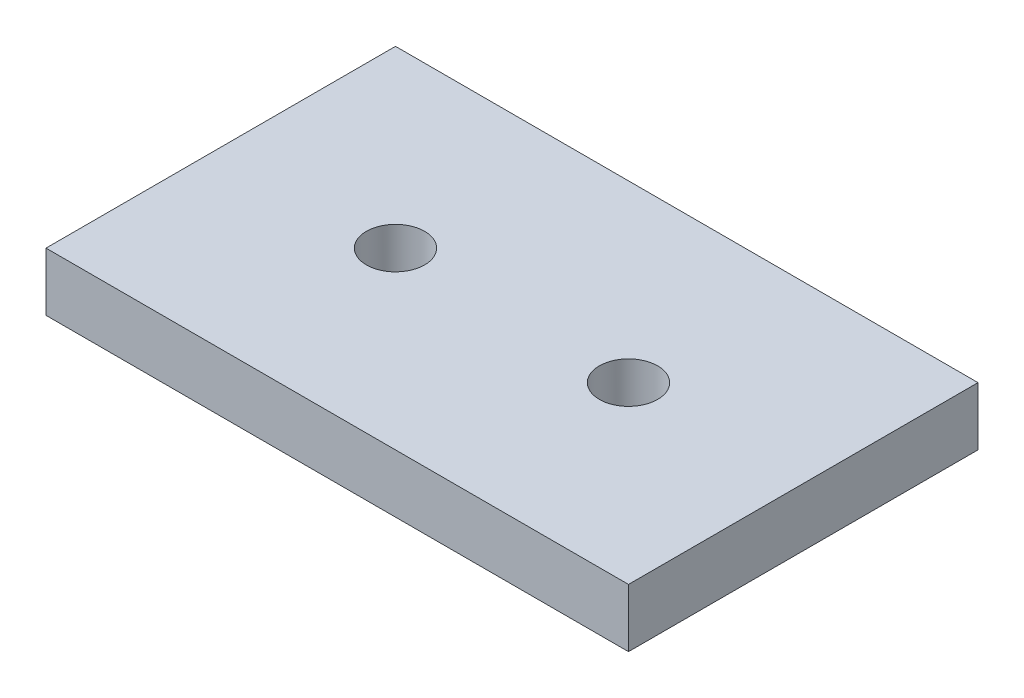
from build123d import *

# Parameters (mm, degrees)
SKETCH_1_W          = 100
SKETCH_1_H          = 60
EXTRUDE_1_DEPTH     = 10
SKETCH_2_R          = 5
CUT_EXTRUDE_1_DEPTH = 20
SKETCH_3_R          = 5
CUT_EXTRUDE_2_DEPTH = 20


with BuildPart() as part:
    # 草图1 → 凸台-拉伸1 (new body)
    with BuildSketch(Plane(origin=(0, 0, 0), x_dir=(1, 0, 0), z_dir=(0, 1, 0))):
        Rectangle(SKETCH_1_W, SKETCH_1_H)
    extrude(amount=EXTRUDE_1_DEPTH)

    # 草图2 → 切除-拉伸1 (cut)
    with BuildSketch(Plane(origin=(0, 0, 0), x_dir=(1, 0, 0), z_dir=(0, 1, 0))):
        with Locations(Location((-20, 0, 0), (0, 0, 90))):
            Circle(SKETCH_2_R)
    extrude(amount=CUT_EXTRUDE_1_DEPTH, mode=Mode.SUBTRACT)

    # 草图3 → 切除-拉伸2 (cut)
    with BuildSketch(Plane(origin=(0, 0, 0), x_dir=(1, 0, 0), z_dir=(0, 1, 0))):
        with Locations(Location((20, 0, 0), (0, 0, 90))):
            Circle(SKETCH_3_R)
    extrude(amount=CUT_EXTRUDE_2_DEPTH, mode=Mode.SUBTRACT)


solid = part.part
